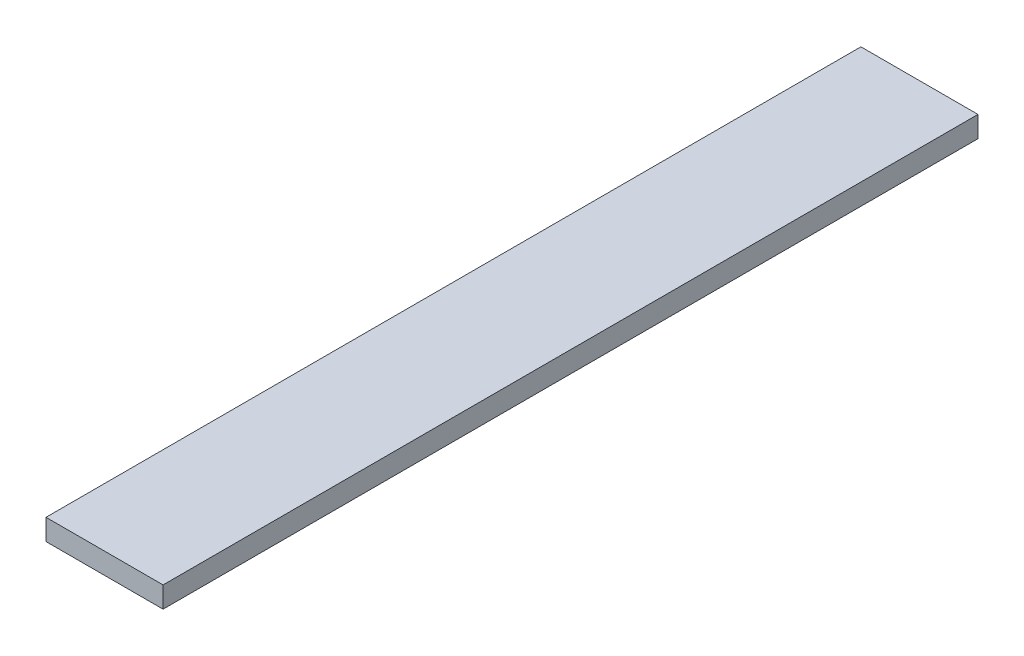
from build123d import *

# Parameters (mm, degrees)
SKETCH1_W           = 101.6
SKETCH1_H           = 707.136
BOSS_EXTRUDE1_DEPTH = 18.25625


with BuildPart() as part:
    # Sketch1 → Boss-Extrude1 (new body)
    with BuildSketch(Plane(origin=(0, 0, 0), x_dir=(1, 0, 0), z_dir=(0, 1, 0))):
        Rectangle(SKETCH1_W, SKETCH1_H)
    extrude(amount=BOSS_EXTRUDE1_DEPTH)


solid = part.part
